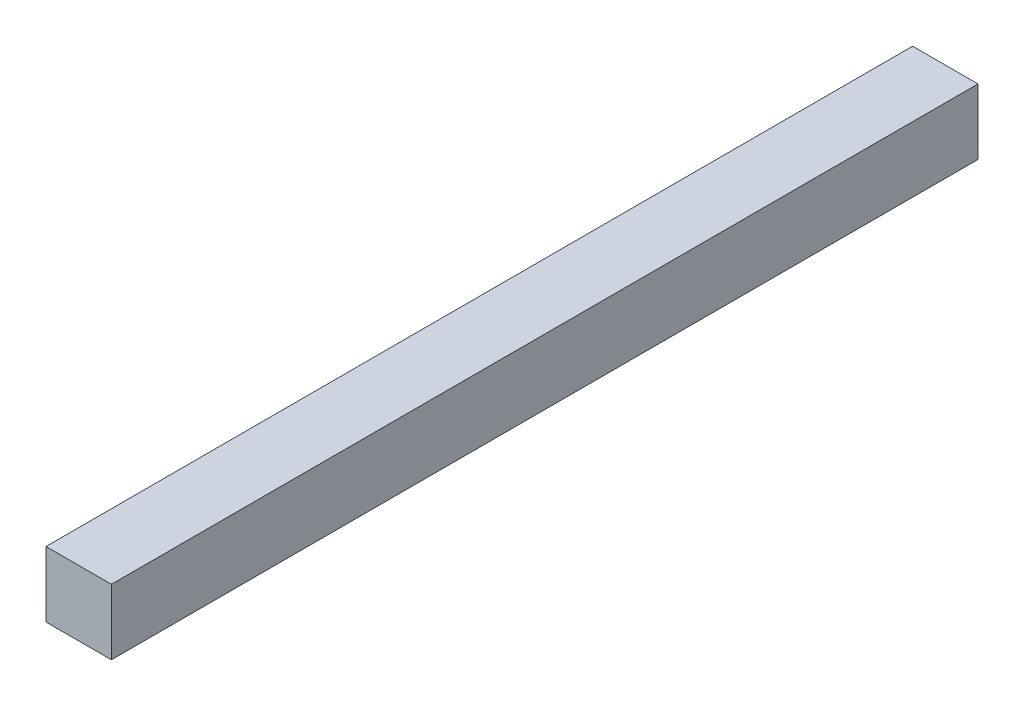
from build123d import *

# Parameters (mm, degrees)
SKETCH1_W           = 20
SKETCH1_H           = 20
BOSS_EXTRUDE1_DEPTH = 265


with BuildPart() as part:
    # Sketch1 → Boss-Extrude1 (new body)
    with BuildSketch(Plane.XY):
        Rectangle(SKETCH1_W, SKETCH1_H)
    extrude(amount=BOSS_EXTRUDE1_DEPTH)


solid = part.part
